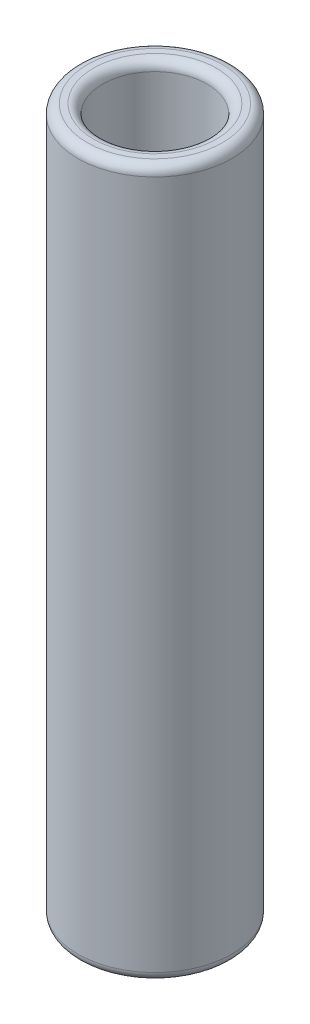
from build123d import *

# Parameters (mm, degrees)
SKETCH1_R           = 2.5
SKETCH1_R_2         = 1.7
BOSS_EXTRUDE1_DEPTH = 23
FILLET1_R           = 0.3


with BuildPart() as part:
    # Sketch1 → Boss-Extrude1 (new body)
    with BuildSketch(Plane(origin=(0, 0, 0), x_dir=(1, 0, 0), z_dir=(0, 1, 0))):
        with Locations(Location((0, 0, 0), (0, 0, 270))):
            Circle(SKETCH1_R)
        with Locations(Location((0, 0, 0), (0, 0, 270))):
            Circle(SKETCH1_R_2, mode=Mode.SUBTRACT)
    extrude(amount=BOSS_EXTRUDE1_DEPTH)

    # Fillet1
    fillet1_edges = [part.edges().sort_by_distance(p)[0] for p in [
        (0, 0, -2.5),
        (0, 23, -2.5),
        (0, 0, -1.7),
        (0, 23, -1.7),
    ]]
    fillet(fillet1_edges, radius=FILLET1_R)


solid = part.part
